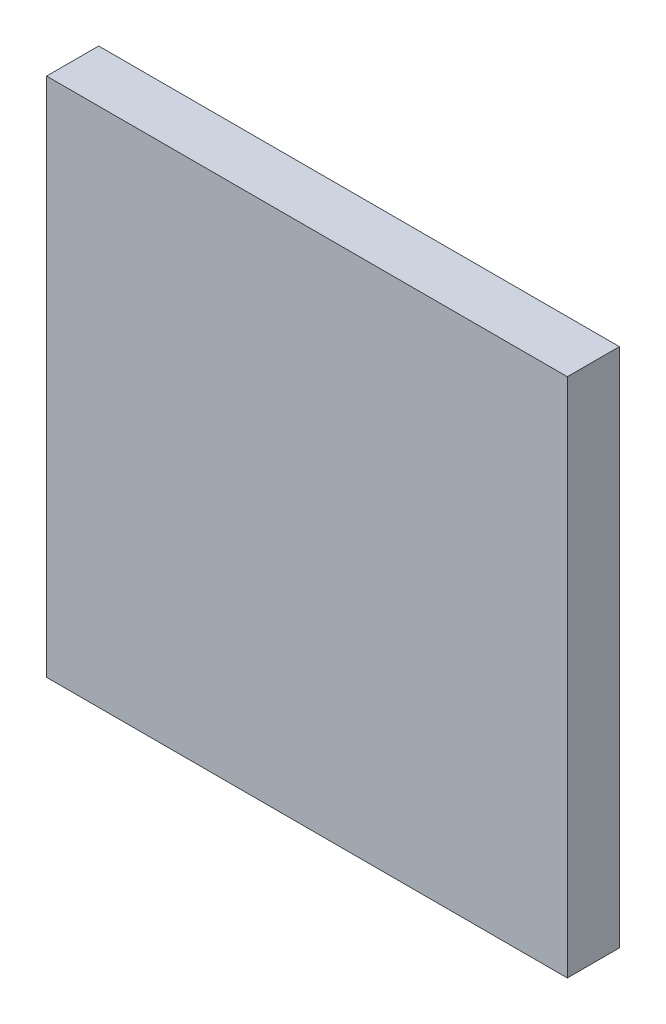
from build123d import *

# Parameters (mm, degrees)
SKETCH2_W           = 100
SKETCH2_H           = 100
BOSS_EXTRUDE1_DEPTH = 10
SKETCH3_W           = 88.096165101
SKETCH3_H           = 90
CUT_EXTRUDE1_DEPTH  = 5


with BuildPart() as part:
    # Sketch2 → Boss-Extrude1 (new body)
    with BuildSketch(Plane.XY):
        with Locations((0, 50)):
            Rectangle(SKETCH2_W, SKETCH2_H)
    extrude(amount=BOSS_EXTRUDE1_DEPTH)

    # Sketch3 → Cut-Extrude1 (cut)
    with BuildSketch(Plane(origin=(0, 0, 0), x_dir=(-1, 0, 0), z_dir=(0, 0, -1))):
        with Locations((0.951917449, 50)):
            Rectangle(SKETCH3_W, SKETCH3_H)
    extrude(amount=-CUT_EXTRUDE1_DEPTH, mode=Mode.SUBTRACT)


solid = part.part
